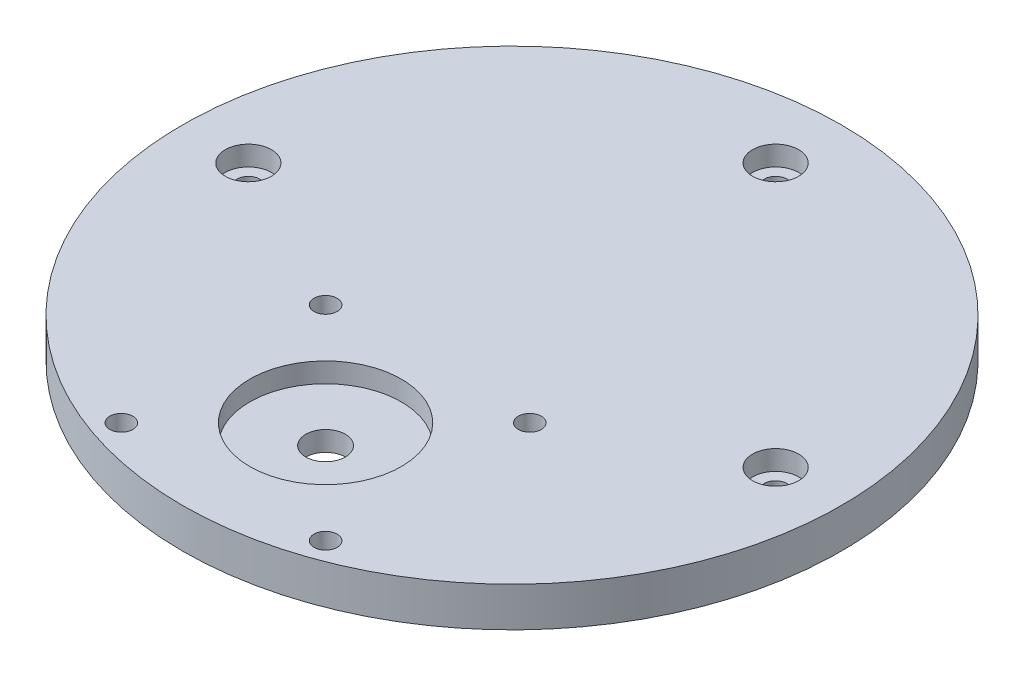
from build123d import *

# Parameters (mm, degrees)
SKETCH_1_R          = 50
EXTRUDE_1_DEPTH     = 6
SKETCH_2_R          = 1.75
CUT_EXTRUDE_1_DEPTH = 24
SKETCH_4_R          = 3
CUT_EXTRUDE_2_DEPTH = 24
SKETCH_5_R          = 11.5
CUT_EXTRUDE_3_DEPTH = 3
SKETCH_6_R          = 1.75
CUT_EXTRUDE_4_DEPTH = 37
SKETCH_7_R          = 3
CUT_EXTRUDE_5_DEPTH = 3
SKETCH_8_R          = 3.5
CUT_EXTRUDE_6_DEPTH = 3


with BuildPart() as part:
    # 草图1 → 凸台-拉伸1 (new body)
    with BuildSketch(Plane(origin=(0, 0, 0), x_dir=(1, 0, 0), z_dir=(0, 1, 0))):
        with Locations(Location((0, 0, 0), (0, 0, 270))):
            Circle(SKETCH_1_R)
    extrude(amount=EXTRUDE_1_DEPTH)

    # 草图2 → 切除-拉伸1 (cut)
    with BuildSketch(Plane(origin=(0, 6, 0), x_dir=(1, 0, 0), z_dir=(0, 1, 0))):
        with Locations(Location((0, 40, 0), (0, 0, 270))):
            Circle(SKETCH_2_R)
        with Locations(Location((40, 0, 0), (0, 0, 270))):
            Circle(SKETCH_2_R)
        with Locations(Location((-40, 0, 0), (0, 0, 270))):
            Circle(SKETCH_2_R)
    extrude(amount=-CUT_EXTRUDE_1_DEPTH, mode=Mode.SUBTRACT)

    # 草图4 → 切除-拉伸2 (cut)
    with BuildSketch(Plane.XZ):
        with Locations(Location((0, 28.284271247, 0), (0, 0, 270))):
            Circle(SKETCH_4_R)
    extrude(amount=-CUT_EXTRUDE_2_DEPTH, mode=Mode.SUBTRACT)

    # 草图5 → 切除-拉伸3 (cut)
    with BuildSketch(Plane(origin=(0, 6, 0), x_dir=(1, 0, 0), z_dir=(0, 1, 0))):
        with Locations(Location((0, -28.284271247, 0), (0, 0, 270))):
            Circle(SKETCH_5_R)
    extrude(amount=-CUT_EXTRUDE_3_DEPTH, mode=Mode.SUBTRACT)

    # 草图6 → 切除-拉伸4 (cut)
    with BuildSketch(Plane(origin=(0, 6, 0), x_dir=(1, 0, 0), z_dir=(0, 1, 0))):
        with Locations(Location((15.494, -12.790271247, 0), (0, 0, 270))):
            Circle(SKETCH_6_R)
        with Locations(Location((15.494, -43.778271247, 0), (0, 0, 270))):
            Circle(SKETCH_6_R)
        with Locations(Location((-15.494, -43.778271247, 0), (0, 0, 270))):
            Circle(SKETCH_6_R)
        with Locations(Location((-15.494, -12.790271247, 0), (0, 0, 270))):
            Circle(SKETCH_6_R)
    extrude(amount=-CUT_EXTRUDE_4_DEPTH, mode=Mode.SUBTRACT)

    # 草图7 → 切除-拉伸5 (cut)
    with BuildSketch(Plane.XZ):
        with Locations(Location((15.494, 43.778271247, 0), (0, 0, 270))):
            Circle(SKETCH_7_R)
        with Locations(Location((15.494, 12.790271247, 0), (0, 0, 270))):
            Circle(SKETCH_7_R)
        with Locations(Location((-15.494, 12.790271247, 0), (0, 0, 270))):
            Circle(SKETCH_7_R)
        with Locations(Location((-15.494, 43.778271247, 0), (0, 0, 270))):
            Circle(SKETCH_7_R)
    extrude(amount=-CUT_EXTRUDE_5_DEPTH, mode=Mode.SUBTRACT)

    # 草图8 → 切除-拉伸6 (cut)
    with BuildSketch(Plane(origin=(0, 6, 0), x_dir=(1, 0, 0), z_dir=(0, 1, 0))):
        with Locations(Location((0, 40, 0), (0, 0, 270))):
            Circle(SKETCH_8_R)
        with Locations(Location((-40, 0, 0), (0, 0, 270))):
            Circle(SKETCH_8_R)
        with Locations(Location((40, 0, 0), (0, 0, 270))):
            Circle(SKETCH_8_R)
    extrude(amount=-CUT_EXTRUDE_6_DEPTH, mode=Mode.SUBTRACT)


solid = part.part
